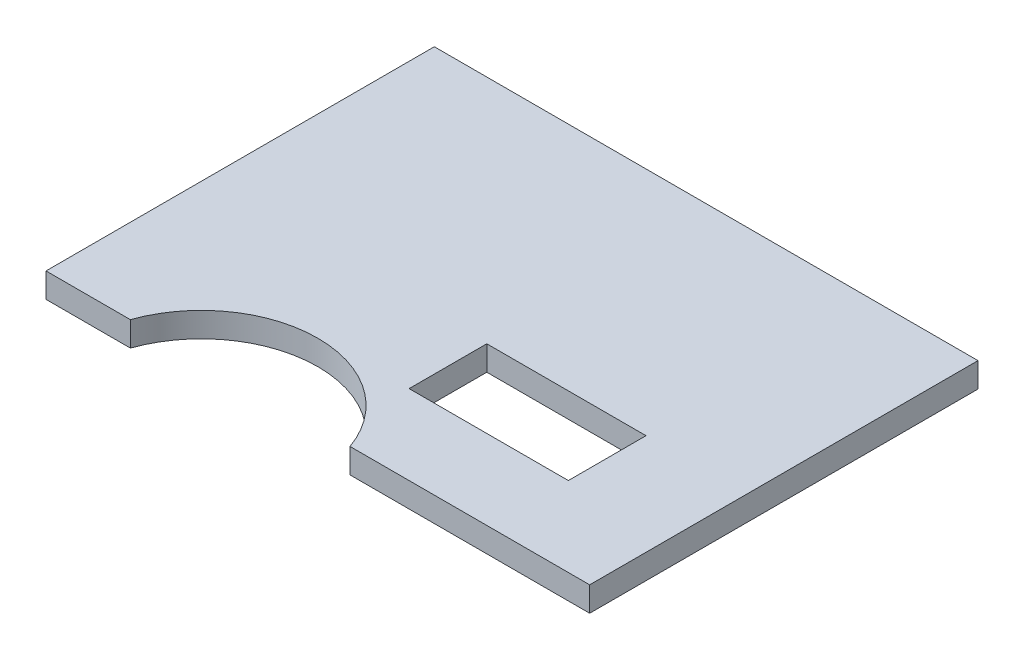
from build123d import *

# Parameters (mm, degrees)
SKETCH1_W           = 140
SKETCH1_H           = 100
BOSS_EXTRUDE1_DEPTH = 6.35
SKETCH2_W           = 41
SKETCH2_H           = 20
CUT_EXTRUDE1_DEPTH  = 10
SKETCH3_R           = 30
CUT_EXTRUDE2_DEPTH  = 10


with BuildPart() as part:
    # Sketch1 → Boss-Extrude1 (new body)
    with BuildSketch(Plane(origin=(0, 0, 0), x_dir=(1, 0, 0), z_dir=(0, 1, 0))):
        with Locations((70, 50)):
            Rectangle(SKETCH1_W, SKETCH1_H)
    extrude(amount=BOSS_EXTRUDE1_DEPTH)

    # Sketch2 → Cut-Extrude1 (cut)
    with BuildSketch(Plane(origin=(0, 6.35, 0), x_dir=(1, 0, 0), z_dir=(0, 1, 0))):
        with Locations((93.5, 30.51)):
            Rectangle(SKETCH2_W, SKETCH2_H)
    extrude(amount=-CUT_EXTRUDE1_DEPTH, mode=Mode.SUBTRACT)

    # Sketch3 → Cut-Extrude2 (cut)
    with BuildSketch(Plane(origin=(0, 6.35, 0), x_dir=(1, 0, 0), z_dir=(0, 1, 0))):
        with Locations((50, -10)):
            Circle(SKETCH3_R)
    extrude(amount=-CUT_EXTRUDE2_DEPTH, mode=Mode.SUBTRACT)


solid = part.part
